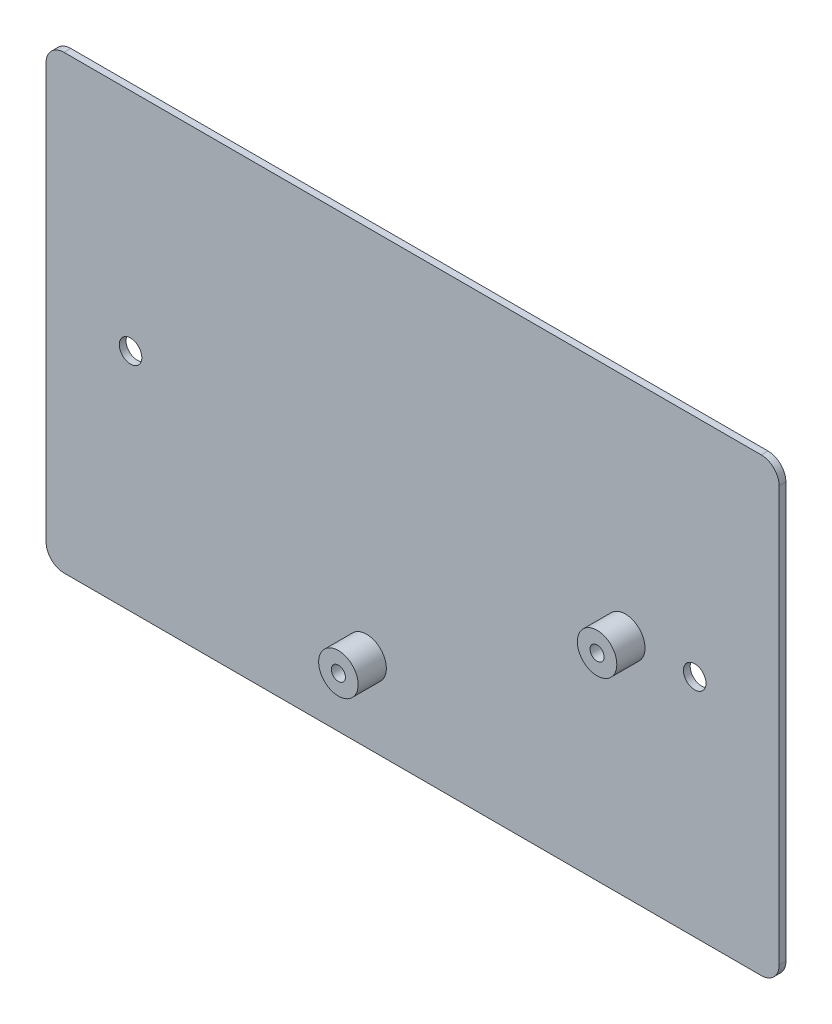
from build123d import *

# Parameters (mm, degrees)
SKETCH1_W                      = 129.93
SKETCH1_H                      = 79.93
BOSS_EXTRUDE1_DEPTH            = 1.2
FILLET1_R                      = 3.175
CUT_EXTRUDE2_REACH             = 78.283
SKETCH3_R                      = 2
CUT_EXTRUDE1_REACH             = 78.283
SKETCH2_R                      = 1.25
CUT_EXTRUDE1_DIRECTION_2_DEPTH = 77.282976148
BOSS_EXTRUDE2_START            = 5
SKETCH4_R                      = 3.5
SKETCH4_R_2                    = 1.25
BOSS_EXTRUDE2_DEPTH            = 5


with BuildPart() as part:
    # Sketch1 → Boss-Extrude1 (new body)
    with BuildSketch(Plane.XY):
        Rectangle(SKETCH1_W, SKETCH1_H)
    extrude(amount=BOSS_EXTRUDE1_DEPTH)

    # Fillet1
    fillet1_edges = [part.edges().sort_by_distance(p)[0] for p in [
        (64.965, -39.965, 0.6),
        (-64.965, -39.965, 0.6),
        (-64.965, 39.965, 0.6),
        (64.965, 39.965, 0.6),
    ]]
    fillet(fillet1_edges, radius=FILLET1_R)

    # Sketch3 → Cut-Extrude2 (cut, up to next)
    with BuildSketch(Plane.XY.offset(1.2), mode=Mode.PRIVATE) as cut_extrude2_sk1:
        with Locations((-50, 0)):
            Circle(SKETCH3_R)
    cut_extrude2_tool1 = extrude(cut_extrude2_sk1.sketch, amount=-CUT_EXTRUDE2_REACH, mode=Mode.PRIVATE) & part.part
    # Sketch3 → Cut-Extrude2 (cut, up to next)
    with BuildSketch(Plane.XY.offset(1.2), mode=Mode.PRIVATE) as cut_extrude2_sk2:
        with Locations(Location((50, 0, 0), (0, 0, 180))):
            Circle(SKETCH3_R)
    cut_extrude2_tool2 = extrude(cut_extrude2_sk2.sketch, amount=-CUT_EXTRUDE2_REACH, mode=Mode.PRIVATE) & part.part
    add(cut_extrude2_tool1.solids().sort_by_distance((-50, 0, 1.2))[0], mode=Mode.SUBTRACT)
    add(cut_extrude2_tool2.solids().sort_by_distance((50, 0, 1.2))[0], mode=Mode.SUBTRACT)

    # Sketch2 → Cut-Extrude1 (cut, up to next)
    with BuildSketch(Plane.XY.offset(1.2), mode=Mode.PRIVATE) as cut_extrude1_sk1:
        with Locations(Location((-8.156928596, -26.04, 0), (0, 0, 180))):
            Circle(SKETCH2_R)
    cut_extrude1_tool1 = extrude(cut_extrude1_sk1.sketch, amount=-CUT_EXTRUDE1_REACH, mode=Mode.PRIVATE) & part.part
    # Sketch2 → Cut-Extrude1 (cut, up to next)
    with BuildSketch(Plane.XY.offset(1.2), mode=Mode.PRIVATE) as cut_extrude1_sk2:
        with Locations(Location((37.693071404, 0, 0), (0, 0, 180))):
            Circle(SKETCH2_R)
    cut_extrude1_tool2 = extrude(cut_extrude1_sk2.sketch, amount=-CUT_EXTRUDE1_REACH, mode=Mode.PRIVATE) & part.part
    add(cut_extrude1_tool1.solids().sort_by_distance((-8.156929, -26.04, 1.2))[0], mode=Mode.SUBTRACT)
    add(cut_extrude1_tool2.solids().sort_by_distance((37.693071, 0, 1.2))[0], mode=Mode.SUBTRACT)

    # Sketch2 → Cut-Extrude1 direction 2 (cut)
    with BuildSketch(Plane.XY.offset(1.2)):
        with Locations(Location((-8.156928596, -26.04, 0), (0, 0, 180))):
            Circle(SKETCH2_R)
        with Locations(Location((37.693071404, 0, 0), (0, 0, 180))):
            Circle(SKETCH2_R)
    extrude(amount=CUT_EXTRUDE1_DIRECTION_2_DEPTH, mode=Mode.SUBTRACT)

    # Sketch4 → Boss-Extrude2 (add)
    # profile 1 of 2: a face of its own
    with BuildSketch(Plane.XY.offset(1.2).offset(BOSS_EXTRUDE2_START)):
        with Locations(Location((-8.156928596, -26.04, 0), (0, 0, 180))):
            Circle(SKETCH4_R)
        with Locations(Location((-8.156928596, -26.04, 0), (0, 0, 180))):
            Circle(SKETCH4_R_2, mode=Mode.SUBTRACT)
    # profile 2 of 2: a face of its own
    with BuildSketch(Plane.XY.offset(1.2).offset(BOSS_EXTRUDE2_START)):
        with Locations(Location((37.693071404, 0, 0), (0, 0, 180))):
            Circle(SKETCH4_R)
        with Locations(Location((37.693071404, 0, 0), (0, 0, 180))):
            Circle(SKETCH4_R_2, mode=Mode.SUBTRACT)
    extrude(amount=-BOSS_EXTRUDE2_DEPTH)


solid = part.part
